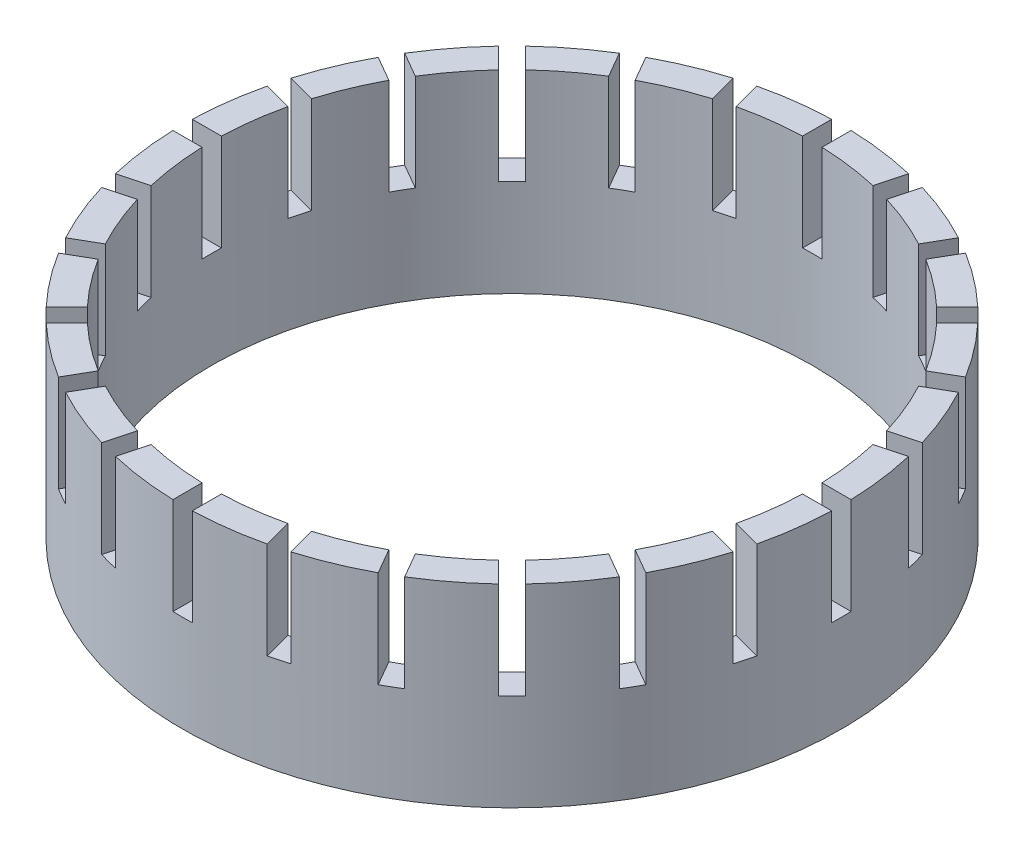
from build123d import *

# Parameters (mm, degrees)
SKETCH1_W          = 3
SKETCH1_H          = 20
SKETCH2_W          = 2
SKETCH2_H          = 38.722689076
CUT_EXTRUDE1_DEPTH = 40
CIRPATTERN1_COUNT  = 24


with BuildPart() as part:
    # Sketch1 → Revolve1 (revolve)
    with BuildSketch(Plane.XY, mode=Mode.PRIVATE) as revolve1_sk:
        with Locations((-32.5, 10)):
            Rectangle(SKETCH1_W, SKETCH1_H)
    revolve(revolve1_sk.sketch.rotate(Axis((0, -1.909188309, 0), (0, 1, 0)), 270), axis=Axis((0, -1.909188309, 0), (0, 1, 0)))

    # Sketch2 → Cut-Extrude1 (cut)
    with BuildSketch(Plane.XY):
        with Locations((0, 29.361344538)):
            Rectangle(SKETCH2_W, SKETCH2_H)
    cut_extrude1 = extrude(amount=-CUT_EXTRUDE1_DEPTH, mode=Mode.SUBTRACT)

    # CirPattern1: Cut-Extrude1 ×24 about axis
    cirpattern1_axis = Axis((0, 0, 0), (0, 1, 0))
    for i in range(1, CIRPATTERN1_COUNT):
        add(cut_extrude1.rotate(cirpattern1_axis, i * 360 / CIRPATTERN1_COUNT), mode=Mode.SUBTRACT)


solid = part.part
